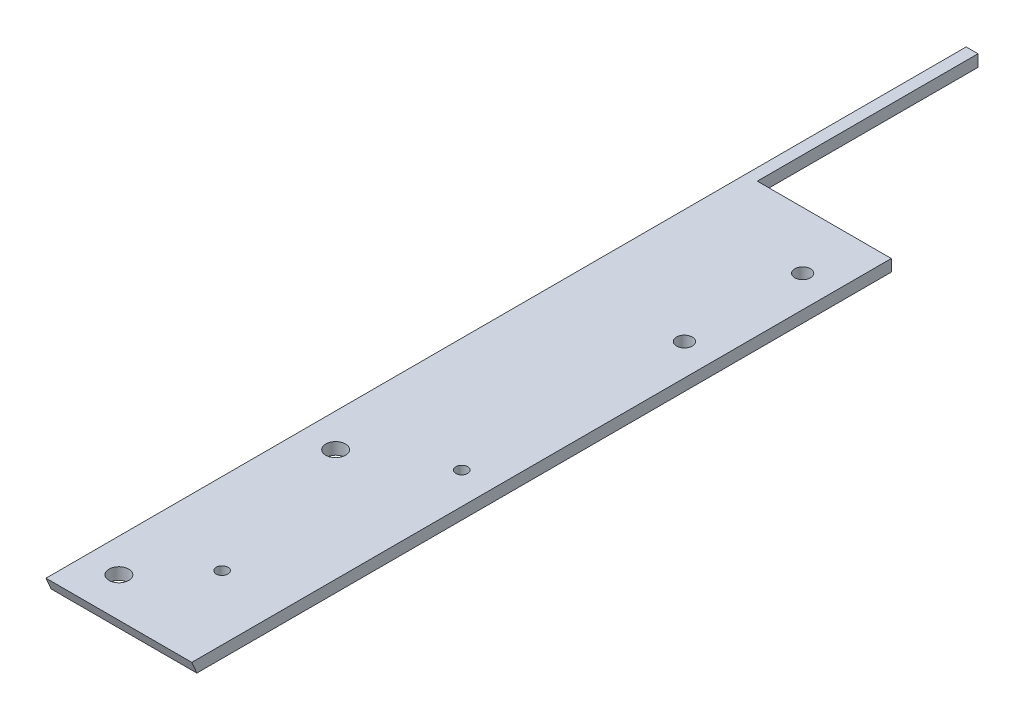
from build123d import *

# Parameters (mm, degrees)
EXTRUDE_1_DEPTH           = 150
EXTRUDE_1_DEPTH_BACK      = 150
SKETCH_4_R                = 2.5
CUT_EXTRUDE_4_DEPTH       = 3
SKETCH_5_W                = 52
SKETCH_5_H                = 100
CUT_EXTRUDE_5_DEPTH       = 3
SKETCH_7_R                = 1.6
SKETCH_7_R_2              = 6.5
CUT_EXTRUDE_9_DEPTH       = 185.063533313
SKETCH_6_W                = 40
SKETCH_6_H                = 200
CUT_EXTRUDE_10_DEPTH      = 10
CUT_EXTRUDE_12_DEPTH      = 4
SKETCH_12_W               = 34
SKETCH_12_H               = 110
CUT_EXTRUDE_13_DEPTH      = 4
SKETCH_14_W               = 4.2
SKETCH_14_H               = 14
CUT_EXTRUDE_14_DEPTH      = 10
SKETCH_15_R               = 2
CUT_EXTRUDE_15_DEPTH      = 26
SKETCH_17_R               = 1.5
CUT_EXTRUDE_19_DEPTH      = 10
CUT_EXTRUDE_20_DEPTH      = 10
CUT_EXTRUDE_21_DEPTH      = 31
SKETCH_22_R               = 1.5
CUT_EXTRUDE_22_DEPTH      = 31
SKETCH_23_W               = 12
SKETCH_23_H               = 87.5
EXTRUDE_3_DEPTH           = 3
CUT_EXTRUDE_23_DEPTH      = 18
CUT_EXTRUDE_24_DEPTH      = 13
CUT_EXTRUDE_24_DEPTH_BACK = 4
SKETCH_25_R               = 1.5
SKETCH_26_R               = 2
CUT_EXTRUDE_25_DEPTH      = 10
CUT_EXTRUDE_29_DEPTH      = 10
CUT_EXTRUDE_30_DEPTH      = 3
SKETCH_34_W               = 3
SKETCH_34_H               = 40
CUT_EXTRUDE_31_DEPTH      = 10


with BuildPart() as part:
    # 草图1 → 凸台-拉伸1 (new, two sides: drawn at the far end of the back side and taken through both)
    with BuildSketch(Plane.XY.offset(-EXTRUDE_1_DEPTH_BACK)):
        Polygon((0, 4.173281966), (0, -73.826718034), (3, -73.826718034), (3, 1.173281966), (3, 3.173281966), (5, 3.173281966), (80, 3.173281966), (80, 6.173281966), (2, 6.173281966), (0, 6.173281966), align=None)
    extrude(amount=EXTRUDE_1_DEPTH + EXTRUDE_1_DEPTH_BACK)

    # 草图4 → 切除-拉伸4 (cut)
    with BuildSketch(Plane(origin=(0, 6.173281966, 0), x_dir=(1, 0, 0), z_dir=(0, 1, 0))):
        with Locations(Location((11.5, -72.5, 0), (0, 0, 180))):
            Circle(SKETCH_4_R)
        with Locations(Location((11.5, -127.5, 0), (0, 0, 180))):
            Circle(SKETCH_4_R)
    extrude(amount=-CUT_EXTRUDE_4_DEPTH, mode=Mode.SUBTRACT)

    # 草图5 → 切除-拉伸5 (cut)
    with BuildSketch(Plane(origin=(0, 6.173281966, 0), x_dir=(1, 0, 0), z_dir=(0, 1, 0))):
        with Locations((54, -100)):
            Rectangle(SKETCH_5_W, SKETCH_5_H)
    extrude(amount=-CUT_EXTRUDE_5_DEPTH, mode=Mode.SUBTRACT)

    # 草图7 → 切除-拉伸9 (cut, through all)
    with BuildSketch(Plane(origin=(3, 0, 0), x_dir=(0, 0, -1), z_dir=(1, 0, 0))):
        with Locations(Location((-54.5, -43.826718034, 0), (0, 0, 90))):
            Circle(SKETCH_7_R)
        with Locations(Location((-62.25, -30.403324275, 0), (0, 0, 90))):
            Circle(SKETCH_7_R)
        with Locations(Location((-62.25, -57.250111793, 0), (0, 0, 90))):
            Circle(SKETCH_7_R)
        with Locations(Location((-77.75, -30.403324275, 0), (0, 0, 90))):
            Circle(SKETCH_7_R)
        with Locations(Location((-77.75, -57.250111793, 0), (0, 0, 90))):
            Circle(SKETCH_7_R)
        with Locations(Location((-85.5, -43.826718034, 0), (0, 0, 90))):
            Circle(SKETCH_7_R)
        with Locations(Location((115.5, -43.826718034, 0), (0, 0, 90))):
            Circle(SKETCH_7_R)
        with Locations(Location((107.75, -30.403324275, 0), (0, 0, 90))):
            Circle(SKETCH_7_R)
        with Locations(Location((107.75, -57.250111793, 0), (0, 0, 90))):
            Circle(SKETCH_7_R)
        with Locations(Location((92.25, -30.403324275, 0), (0, 0, 90))):
            Circle(SKETCH_7_R)
        with Locations(Location((92.25, -57.250111793, 0), (0, 0, 90))):
            Circle(SKETCH_7_R)
        with Locations(Location((84.5, -43.826718034, 0), (0, 0, 90))):
            Circle(SKETCH_7_R)
        with Locations(Location((-70, -50.826718034, 0), (0, 0, 90))):
            Circle(SKETCH_7_R_2)
        with Locations(Location((100, -50.826718034, 0), (0, 0, 90))):
            Circle(SKETCH_7_R_2)
    extrude(amount=-CUT_EXTRUDE_9_DEPTH, mode=Mode.SUBTRACT)

    # 草图6 → 切除-拉伸10 (cut)
    with BuildSketch(Plane(origin=(0, 6.173281966, 0), x_dir=(1, 0, 0), z_dir=(0, 1, 0))):
        with Locations((60, 50)):
            Rectangle(SKETCH_6_W, SKETCH_6_H)
    extrude(amount=-CUT_EXTRUDE_10_DEPTH, mode=Mode.SUBTRACT)

    # 草图11 → 切除-拉伸12 (cut)
    with BuildSketch(Plane.ZY):
        Polygon((-128.345117246, -73.826718034), (-150, -73.826718034), (-150, 3.173281966), align=None)
    extrude(amount=-CUT_EXTRUDE_12_DEPTH, mode=Mode.SUBTRACT)

    # 草图12 → 切除-拉伸13 (cut)
    with BuildSketch(Plane(origin=(0, 6.173281966, 0), x_dir=(1, 0, 0), z_dir=(0, 1, 0))):
        with Locations((23, 95)):
            Rectangle(SKETCH_12_W, SKETCH_12_H)
    extrude(amount=-CUT_EXTRUDE_13_DEPTH, mode=Mode.SUBTRACT)

    # 草图14 → 切除-拉伸14 (cut)
    with BuildSketch(Plane.XZ.offset(-3.173281966)):
        with Locations((5.1, -103)):
            Rectangle(SKETCH_14_W, SKETCH_14_H)
    extrude(amount=-CUT_EXTRUDE_14_DEPTH, mode=Mode.SUBTRACT)

    # 草图15 → 切除-拉伸15 (cut)
    with BuildSketch(Plane(origin=(0, 6.173281966, 0), x_dir=(1, 0, 0), z_dir=(0, 1, 0))):
        with Locations(Location((32, -4.5, 0), (0, 0, 270))):
            Circle(SKETCH_15_R)
    extrude(amount=-CUT_EXTRUDE_15_DEPTH, mode=Mode.SUBTRACT)

    # 草图17 → 切除-拉伸19 (cut)
    with BuildSketch(Plane.XZ.offset(-3.173281966)):
        with Locations((23.690733746, 113.5)):
            Circle(SKETCH_17_R)
    extrude(amount=-CUT_EXTRUDE_19_DEPTH, mode=Mode.SUBTRACT)

    # 草图18 → 切除-拉伸20 (cut)
    with BuildSketch(Plane.ZY):
        Polygon((150, -73.826718034), (118.550084008, -73.826718034), (150, 0), align=None)
    extrude(amount=-CUT_EXTRUDE_20_DEPTH, mode=Mode.SUBTRACT)

    # 草图21 → 切除-拉伸21 (cut)
    with BuildSketch(Plane.ZY):
        Polygon((118.550084008, -73.826718034), (150, 0), (150, 6.173281966), (137.5, 6.173281966), (132.072189672, -6.568164552), (98.550084008, -73.826718034), align=None)
    extrude(amount=-CUT_EXTRUDE_21_DEPTH, mode=Mode.SUBTRACT)

    # 草图22 → 切除-拉伸22 (cut)
    with BuildSketch(Plane.ZY):
        with Locations(Location((-106, 3.173281966, 0), (0, 0, 270))):
            Circle(SKETCH_22_R)
        with Locations(Location((-100, 3.173281966, 0), (0, 0, 270))):
            Circle(SKETCH_22_R)
        with Locations(Location((-106, -1.826718034, 0), (0, 0, 270))):
            Circle(SKETCH_22_R)
        with Locations(Location((-100, -1.826718034, 0), (0, 0, 270))):
            Circle(SKETCH_22_R)
    extrude(amount=-CUT_EXTRUDE_22_DEPTH, mode=Mode.SUBTRACT)

    # 草图23 → 凸台-拉伸3 (add)
    with BuildSketch(Plane(origin=(0, 6.173281966, 0), x_dir=(1, 0, 0), z_dir=(0, 1, 0))):
        with Locations((34, -93.75)):
            Rectangle(SKETCH_23_W, SKETCH_23_H)
    extrude(amount=-EXTRUDE_3_DEPTH)

    # 草图24 → 切除-拉伸23 (cut)
    with BuildSketch(Plane.ZY.offset(-28)):
        Polygon((137.5, 6.173281966), (137.5, 3.173281966), (136.222010805, 3.173281966), align=None)
    extrude(amount=-CUT_EXTRUDE_23_DEPTH, mode=Mode.SUBTRACT)

    # 草图25 → 切除-拉伸24 (cut, two sides: drawn at the far end of the back side and taken through both)
    with BuildSketch(Plane(origin=(0, 6.173281966, 0), x_dir=(1, 0, 0), z_dir=(0, 1, 0)).offset(-CUT_EXTRUDE_24_DEPTH_BACK)):
        with Locations((32, -61)):
            Circle(SKETCH_25_R)
    extrude(amount=CUT_EXTRUDE_24_DEPTH + CUT_EXTRUDE_24_DEPTH_BACK, mode=Mode.SUBTRACT)

    # 草图26 → 切除-拉伸25 (cut)
    with BuildSketch(Plane.XZ.offset(-3.173281966)):
        with Locations((32, -25.5)):
            Circle(SKETCH_26_R)
    extrude(amount=-CUT_EXTRUDE_25_DEPTH, mode=Mode.SUBTRACT)

    # 草图31 → 切除-拉伸29 (cut)
    with BuildSketch(Plane(origin=(3, 0, 0), x_dir=(0, 0, -1), z_dir=(1, 0, 0))):
        Polygon((-38.550084008, -73.826718034), (-10.102483381, -23.826718034), (39.897516619, -23.826718034), (68.345117246, -73.826718034), align=None)
    extrude(amount=-CUT_EXTRUDE_29_DEPTH, mode=Mode.SUBTRACT)

    # 草图33 → 切除-拉伸30 (cut)
    with BuildSketch(Plane.ZY):
        Polygon((-150, 6.173281966), (-150, -87.897987577), (142.92942198, -91.593646071), (144.162869872, 6.173281966), align=None)
    extrude(amount=-CUT_EXTRUDE_30_DEPTH, mode=Mode.SUBTRACT)


with BuildPart() as cut_extrude_30_piece_1:
    # of the separate pieces the step leaves, piece 1, a body of its own (cut_extrude_30_pieces)
    add(part.part.solids().sort_by_distance((3, 3.173281966, 136.222010805))[0])


with BuildPart() as cut_extrude_30_piece_2:
    # of the separate pieces the step leaves, piece 2, a body of its own (cut_extrude_30_pieces)
    add(part.part.solids().sort_by_distance((6, 6.173281966, -110))[0])

    # 草图34 → 切除-拉伸31 (cut)
    with BuildSketch(Plane(origin=(0, 6.173281966, 0), x_dir=(1, 0, 0), z_dir=(0, 1, 0))):
        with Locations((4.5, 130)):
            Rectangle(SKETCH_34_W, SKETCH_34_H)
    extrude(amount=-CUT_EXTRUDE_31_DEPTH, mode=Mode.SUBTRACT)


solid = cut_extrude_30_piece_1.part
